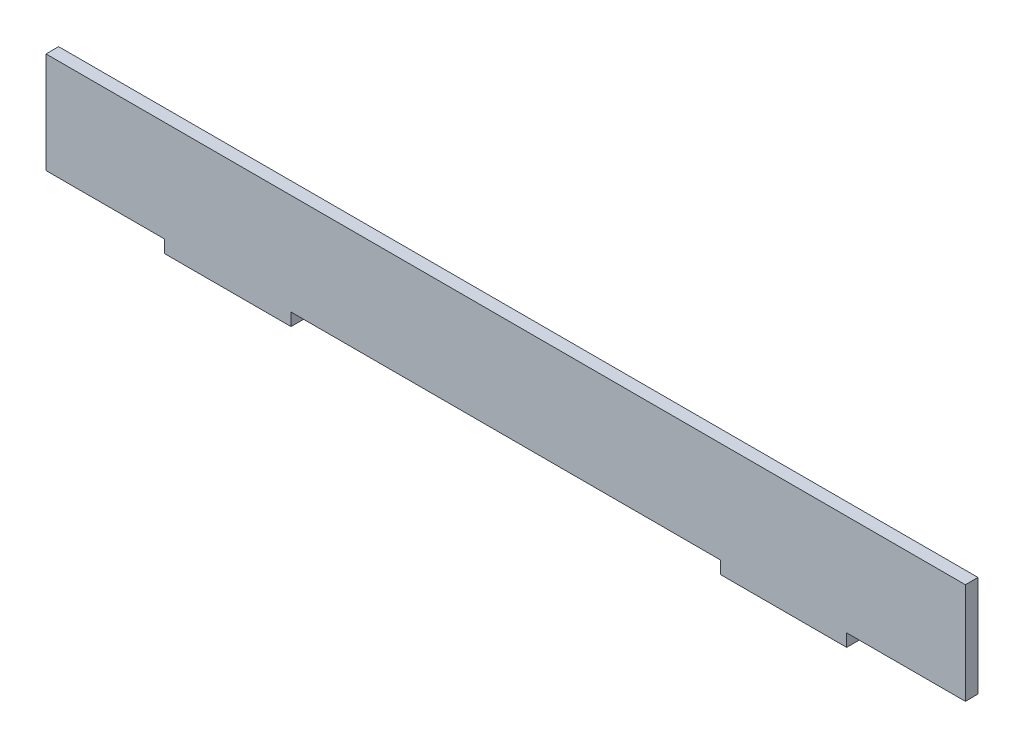
from build123d import *

# Parameters (mm, degrees)
ESQUISSE1_W        = 364
ESQUISSE1_H        = 40
BOSS_EXTRU_1_DEPTH = 5
ESQUISSE2_W        = 50
ESQUISSE2_H        = 5
BOSS_EXTRU_2_DEPTH = 5


with BuildPart() as part:
    # Esquisse1 → Boss.-Extru.1 (new body)
    with BuildSketch(Plane.XY):
        Rectangle(ESQUISSE1_W, ESQUISSE1_H)
    extrude(amount=BOSS_EXTRU_1_DEPTH)

    # Esquisse2 → Boss.-Extru.2 (add)
    with BuildSketch(Plane(origin=(0, 0, 0), x_dir=(-1, 0, 0), z_dir=(0, 0, -1))):
        with Locations((-110, -22.5)):
            Rectangle(ESQUISSE2_W, ESQUISSE2_H)
        with Locations((110, -22.5)):
            Rectangle(ESQUISSE2_W, ESQUISSE2_H)
    extrude(amount=-BOSS_EXTRU_2_DEPTH)


solid = part.part
